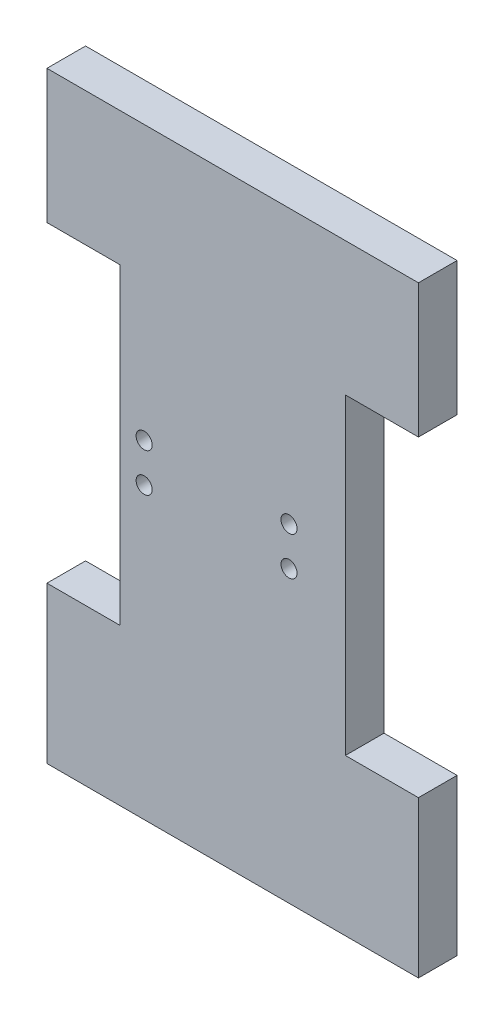
from build123d import *

# Parameters (mm, degrees)
BOSS_EXTRUDE1_DEPTH         = 6
TAP_DRILL_FOR_M6X1_0_TAP1_D = 5


with BuildPart() as part:
    # Sketch2 → Boss-Extrude1 (new, symmetric)
    with BuildSketch(Plane.XY):
        Polygon((-57.7, 90), (57.7, 90), (57.7, 48.5), (35, 48.5), (35, -48.5), (57.7, -48.5), (57.7, -97.0125), (-57.7, -97.0125), (-57.7, -48.5), (-35, -48.5), (-35, 48.5), (-57.7, 48.5), align=None)
    extrude(amount=BOSS_EXTRUDE1_DEPTH, both=True)

    # Tap Drill for M6x1.0 Tap1 (through all)
    with Locations(Plane(origin=(0, 0, -6), x_dir=(-1, 0, 0), z_dir=(0, 0, -1))):
        with Locations((-17.5, 5), (27.5, 5), (27.5, -7), (-17.5, -7)):
            Hole(TAP_DRILL_FOR_M6X1_0_TAP1_D / 2)


solid = part.part
